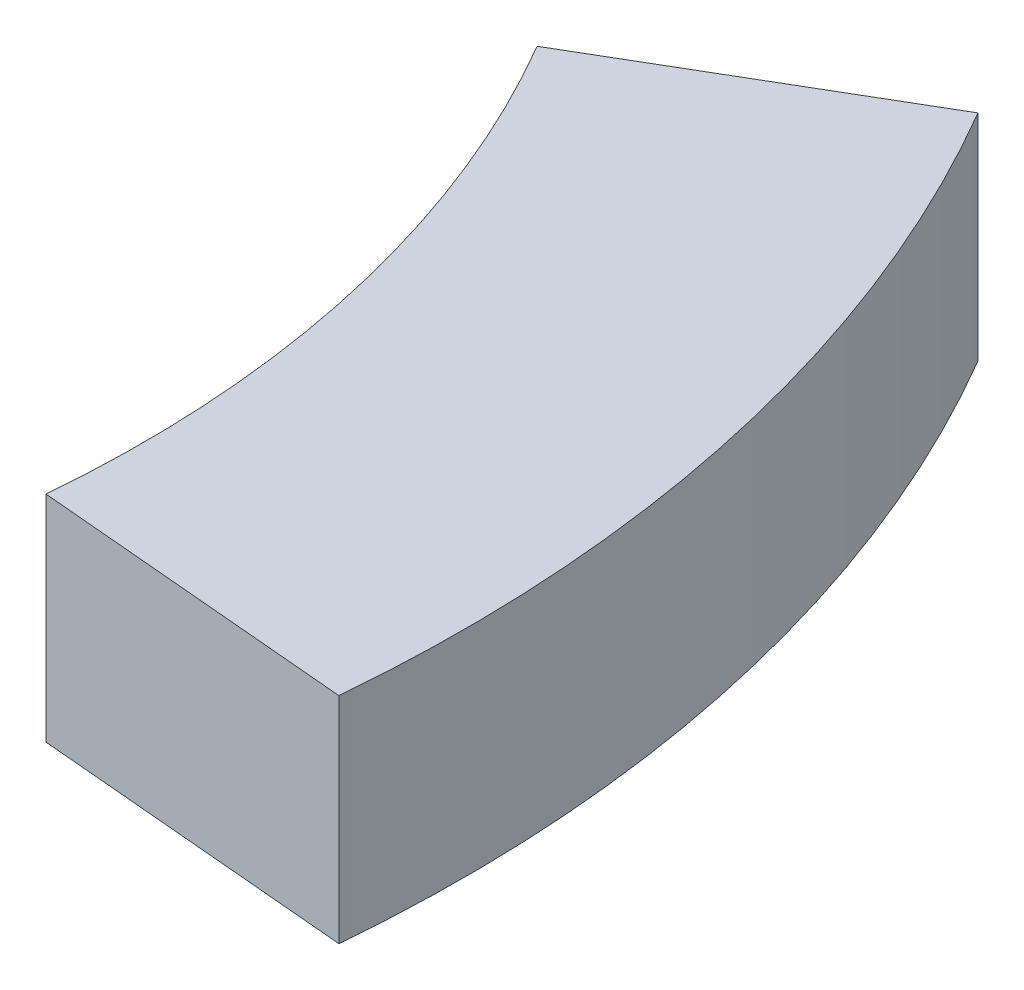
from build123d import *

# Parameters (mm, degrees)
BOSS_EXTRUDE1_DEPTH       = 10
F_5_0MM_DOWEL_HOLE1_D     = 5
F_5_0MM_DOWEL_HOLE1_DEPTH = 6
F_5_0MM_DOWEL_HOLE1_TIP   = 1.502151548


with BuildPart() as part:
    # Sketch1 → Boss-Extrude1 (new body)
    with BuildSketch(Plane(origin=(0, 0, 0), x_dir=(1, 0, 0), z_dir=(0, 1, 0))):
        with BuildLine():
            ThreePointArc((49.589984709, -4.345321229), (48.569954781, 10.909073863), (42.968659609, 25.134492066))
            Line((42.968659609, 25.134492066), (55.916226787, 32.708163842))
            ThreePointArc((55.916226787, 32.708163842), (63.205336897, 14.196259639), (64.532728193, -5.654678771))
            Line((64.532728193, -5.654678771), (49.589984709, -4.345321229))
        make_face()
    extrude(amount=BOSS_EXTRUDE1_DEPTH)

    # Ø5.0mm Dowel Hole1
    with Locations(Plane(origin=(0, 0, 0), x_dir=(-1, 0, 0), z_dir=(0, -1, 0))):
        with Locations((-57.28, 0), (-51.776228177, 24.499399905)):
            Hole(F_5_0MM_DOWEL_HOLE1_D / 2, depth=F_5_0MM_DOWEL_HOLE1_DEPTH)
            with Locations((0, 0, -(F_5_0MM_DOWEL_HOLE1_DEPTH + F_5_0MM_DOWEL_HOLE1_TIP / 2))):  # 118° drill point
                Cone(0, F_5_0MM_DOWEL_HOLE1_D / 2, F_5_0MM_DOWEL_HOLE1_TIP, mode=Mode.SUBTRACT)


solid = part.part
